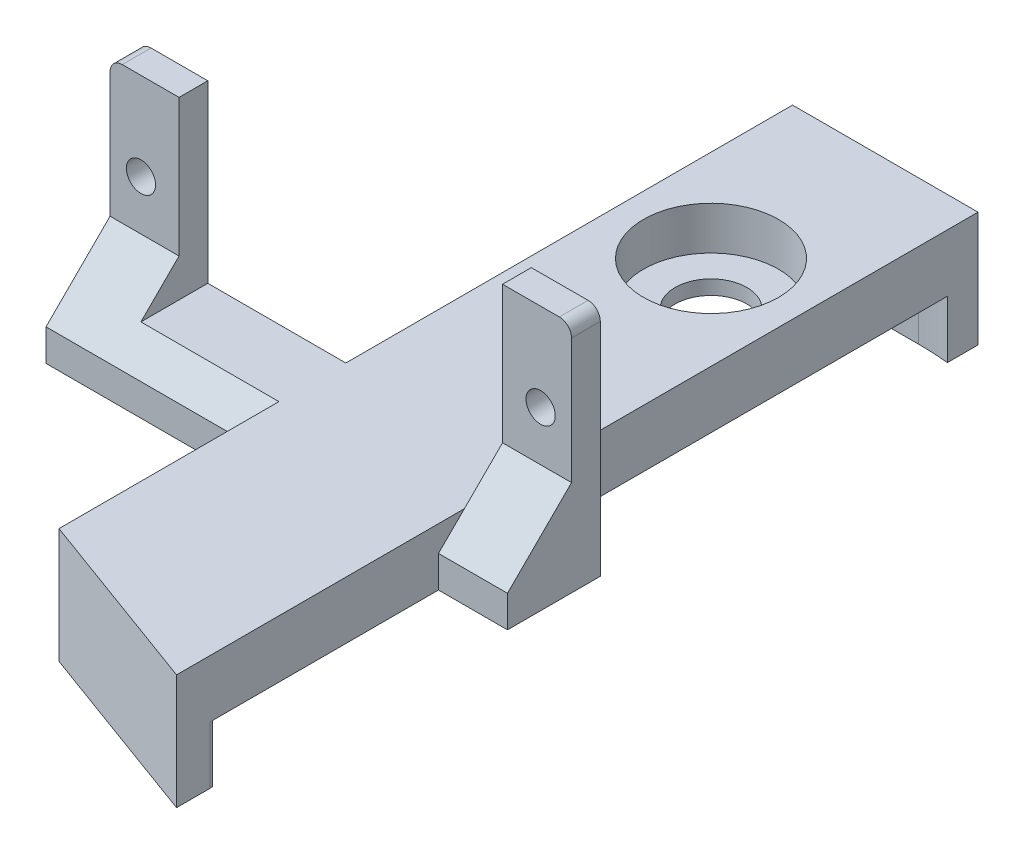
from build123d import *

# Parameters (mm, degrees)
SKETCH1_R                       = 1.016
BOSS_EXTRUDE1_DEPTH             = 2
SKETCH2_R                       = 4.7
BOSS_EXTRUDE2_DEPTH             = 3
BOSS_EXTRUDE5_DEPTH             = 8
BOSS_EXTRUDE6_REACH             = 45.699
BOSS_EXTRUDE6_DIRECTION_2_REACH = 45.699
SKETCH4_W                       = 22.5
SKETCH4_H                       = 14.127681706
CUT_EXTRUDE1_DEPTH              = 7
FILLET1_R                       = 0.5
SKETCH5_R                       = 2.5
BOSS_EXTRUDE7_DEPTH             = 1
SKETCH6_W                       = 5.313656685
SKETCH6_H                       = 4.599259183
SKETCH6_W_2                     = 16.163165117
SKETCH6_H_2                     = 5.344557169
CUT_EXTRUDE2_DEPTH              = 5


with BuildPart() as part:
    # Sketch1 → Boss-Extrude1 (new body)
    # profile 1 of 4: a face of its own
    with BuildSketch(Plane.XY):
        with BuildLine():
            Line((-16.05, 5.25), (-16.05, -5.25))
            ThreePointArc((-16.05, -5.25), (-15.801040764, -5.851040764), (-15.2, -6.1))
            Line((-15.2, -6.1), (-11.25, -6.1))
            Line((-11.25, -6.1), (-11.25, 6.1))
            Line((-11.25, 6.1), (-15.2, 6.1))
            ThreePointArc((-15.2, 6.1), (-15.801040764, 5.851040764), (-16.05, 5.25))
        make_face()
        with Locations((-13.9, 0)):
            Circle(SKETCH1_R, mode=Mode.SUBTRACT)
    # profile 2 of 4: a face of its own
    with BuildSketch(Plane.XY):
        with BuildLine():
            Line((16.05, 5.25), (16.05, -5.25))
            ThreePointArc((16.05, -5.25), (15.801040764, -5.851040764), (15.2, -6.1))
            Line((15.2, -6.1), (11.25, -6.1))
            Line((11.25, -6.1), (11.25, 6.094097151))
            Line((11.25, 6.094097151), (15.2, 6.1))
            ThreePointArc((15.2, 6.1), (15.801040764, 5.851040764), (16.05, 5.25))
        make_face()
        with Locations((13.9, 0)):
            Circle(SKETCH1_R, mode=Mode.SUBTRACT)
    # profile 3 of 4: a face of its own
    with BuildSketch(Plane.XY):
        with BuildLine():
            ThreePointArc((15.2, -6.1), (15.801040764, -5.851040764), (16.05, -5.25))
            Line((16.05, -5.25), (16.05, -6.1))
            Line((16.05, -6.1), (15.2, -6.1))
        make_face()
    # profile 4 of 4: a face of its own
    with BuildSketch(Plane.XY):
        with BuildLine():
            ThreePointArc((-16.05, -5.25), (-15.801040764, -5.851040764), (-15.2, -6.1))
            Line((-15.2, -6.1), (-16.05, -6.1))
            Line((-16.05, -6.1), (-16.05, -5.25))
        make_face()
    extrude(amount=BOSS_EXTRUDE1_DEPTH)

    # Sketch2 → Boss-Extrude2 (add)
    with BuildSketch(Plane.XZ.offset(6.1)):
        Polygon((16.05, 2), (11.25, 2), (11.25, 24.675592953), (-1.65, 19.952742461), (-1.65, 2), (-16.05, 2), (-16.05, 0), (-1.65, 0), (-1.65, -31.072136217), (11.25, -31.072136217), (11.25, 0), (16.05, 0), align=None)
        with Locations((4.75, -19)):
            Circle(SKETCH2_R, mode=Mode.SUBTRACT)
    extrude(amount=BOSS_EXTRUDE2_DEPTH)

    # Sketch2<3> → Boss-Extrude5 (add)
    with BuildSketch(Plane.XZ.offset(6.1)):
        with BuildLine():
            Line((11.231228015, 22.158640143), (11.25, 22.341096015))
            Line((11.25, 22.341096015), (11.25, 24.675592953))
            Line((11.25, 24.675592953), (-1.65, 19.952742461))
            Line((-1.65, 19.952742461), (-1.65, 16.43877001))
            ThreePointArc((-1.65, 16.43877001), (-0.396504625, 17.322324926), (0.97683102, 18.004871005))
            Line((0.97683102, 18.004871005), (11.231228015, 22.158640143))
        make_face()
        with BuildLine():
            ThreePointArc((4.75, -29.05), (1.349414108, -28.457193854), (-1.65, -26.74870957))
            Line((-1.65, -26.74870957), (-1.65, -31.072136217))
            Line((-1.65, -31.072136217), (11.25, -31.072136217))
            Line((11.25, -31.072136217), (11.25, -28.939719159))
            ThreePointArc((11.25, -28.939719159), (10.201434939, -29.022410808), (9.149976222, -29.05))
            Line((9.149976222, -29.05), (4.75, -29.05))
        make_face()
    extrude(amount=BOSS_EXTRUDE5_DEPTH)

    # Boss-Extrude6: up to this face of the body (flat: up to its plane)
    boss_extrude6_end = Plane(part.part.faces().sort_by_distance((16.05, -1.925, 1))[0])
    # Sketch3 → Boss-Extrude6 (add, up to the picked face)
    with BuildSketch(Plane(origin=(11.25, 0, 0), x_dir=(0, 0, -1), z_dir=(1, 0, 0)), mode=Mode.PRIVATE) as boss_extrude6_sk1:
        Polygon((-7.665828596, -9.1), (-2, -3.457464127), (-2, -9.1), align=None)
    boss_extrude6_tool1 = split(extrude(boss_extrude6_sk1.sketch, amount=BOSS_EXTRUDE6_REACH, mode=Mode.PRIVATE), bisect_by=boss_extrude6_end, keep=Keep.BOTH, mode=Mode.PRIVATE)
    add(boss_extrude6_tool1.solids().sort_by(Axis((11.25, -7.219155, 3.88861), (1, 0, 0)))[0])

    # Boss-Extrude6 direction 2: up to this face of the body (flat: up to its plane)
    boss_extrude6_direction_2_end = Plane(part.part.faces().sort_by_distance((-16.05, -1.925, 1))[0])
    # Sketch3 → Boss-Extrude6 direction 2 (add, up to the picked face)
    with BuildSketch(Plane(origin=(11.25, 0, 0), x_dir=(0, 0, -1), z_dir=(1, 0, 0)), mode=Mode.PRIVATE) as boss_extrude6_direction_2_sk1:
        Polygon((-7.665828596, -9.1), (-2, -3.457464127), (-2, -9.1), align=None)
    boss_extrude6_direction_2_tool1 = split(extrude(boss_extrude6_direction_2_sk1.sketch, amount=-BOSS_EXTRUDE6_DIRECTION_2_REACH, mode=Mode.PRIVATE), bisect_by=boss_extrude6_direction_2_end, keep=Keep.BOTH, mode=Mode.PRIVATE)
    add(boss_extrude6_direction_2_tool1.solids().sort_by(Axis((11.25, -7.219155, 3.88861), (-1, 0, 0)))[0])

    # Sketch4 → Cut-Extrude1 (cut)
    with BuildSketch(Plane(origin=(0, -6.1, 0), x_dir=(1, 0, 0), z_dir=(0, 1, 0))):
        with Locations((0, -7.063840853)):
            Rectangle(SKETCH4_W, SKETCH4_H)
    extrude(amount=CUT_EXTRUDE1_DEPTH, mode=Mode.SUBTRACT)

    # Fillet1
    fillet1_edges = [part.edges().sort_by_distance(p)[0] for p in [
        (13.65, -9.1, 7.665828596),
        (-8.85, -9.1, 7.665828596),
    ]]
    fillet(fillet1_edges, radius=FILLET1_R)

    # Sketch5 → Boss-Extrude7 (add)
    with BuildSketch(Plane.XZ.offset(9.1)):
        with BuildLine():
            Line((-1.65, 16.43877001), (-1.65, 6.455196792))
            Line((-1.65, 6.455196792), (-16.05, 6.455196792))
            Line((-16.05, 6.455196792), (-16.05, 0))
            Line((-16.05, 0), (-1.65, 0))
            Line((-1.65, 0), (-1.65, -26.74870957))
            ThreePointArc((-1.65, -26.74870957), (1.349414108, -28.457193854), (4.75, -29.05))
            Line((4.75, -29.05), (9.149976222, -29.05))
            ThreePointArc((9.149976222, -29.05), (10.201434939, -29.022410808), (11.25, -28.939719159))
            Line((11.25, -28.939719159), (11.25, 0))
            Line((11.25, 0), (16.05, 0))
            Line((16.05, 0), (16.05, 6.455196792))
            Line((16.05, 6.455196792), (11.25, 6.455196792))
            Line((11.25, 6.455196792), (11.25, 22.341096015))
            Line((11.25, 22.341096015), (11.231228015, 22.158640143))
            Line((11.231228015, 22.158640143), (0.97683102, 18.004871005))
            ThreePointArc((0.97683102, 18.004871005), (-0.396504625, 17.322324926), (-1.65, 16.43877001))
        make_face()
        with Locations((4.75, -19)):
            Circle(SKETCH5_R, mode=Mode.SUBTRACT)
    extrude(amount=BOSS_EXTRUDE7_DEPTH)

    # Sketch6 → Cut-Extrude2 (cut)
    with BuildSketch(Plane.XY.offset(6.455196792)):
        with Locations((13.906828343, -7.800370409)):
            Rectangle(SKETCH6_W, SKETCH6_H)
        with Locations((-9.731582558, -7.427721416)):
            Rectangle(SKETCH6_W_2, SKETCH6_H_2)
    extrude(amount=CUT_EXTRUDE2_DEPTH, mode=Mode.SUBTRACT)


solid = part.part
